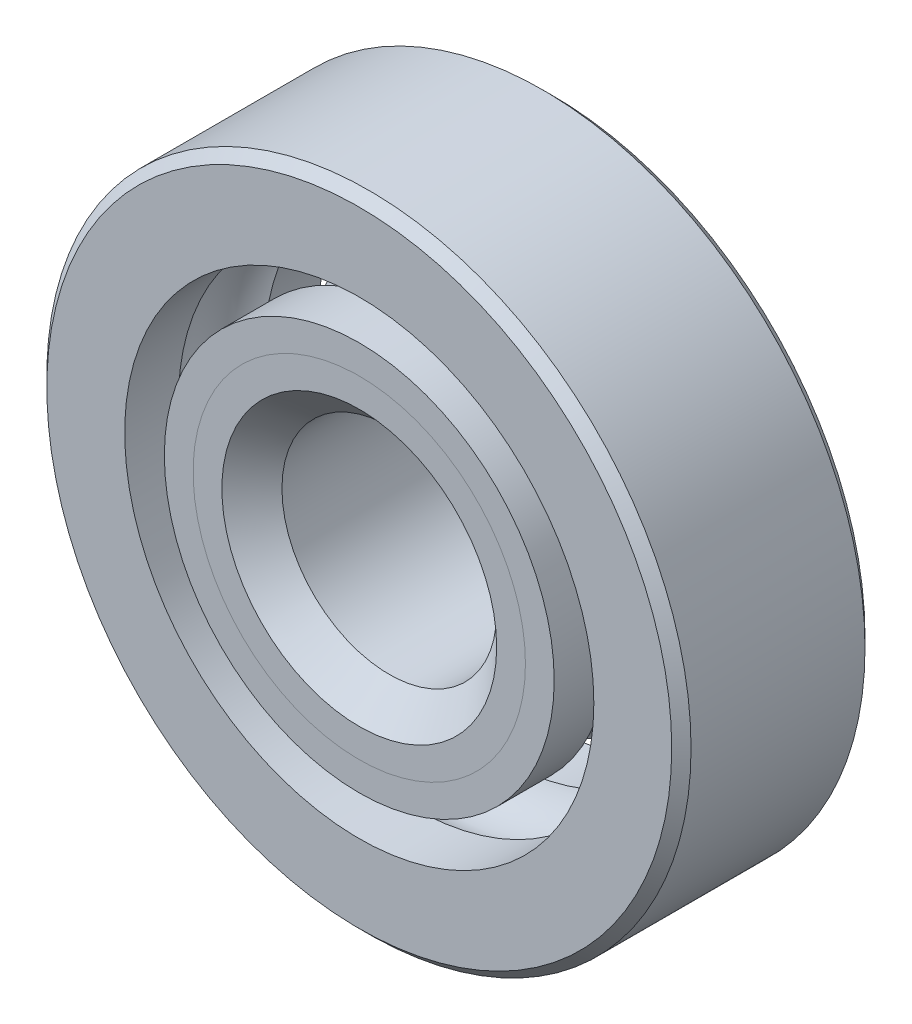
from build123d import *


with BuildPart() as part:
    # Sketch1 → Revolve1 (revolve)
    with BuildSketch(Plane(origin=(0, 0, 0), x_dir=(0, 0, -1), z_dir=(1, 0, 0))):
        with BuildLine():
            Line((4.05, 15), (-4.05, 15))
            Line((-4.05, 15), (-4.5, 14.55))
            Line((-4.5, 14.55), (-4.5, 10.923076923))
            Line((-4.5, 10.923076923), (-2, 10.923076923))
            ThreePointArc((-2, 10.923076923), (0, 12.202741702), (2, 10.923076923))
            Line((2, 10.923076923), (4.5, 10.923076923))
            Line((4.5, 10.923076923), (4.5, 14.55))
            Line((4.5, 14.55), (4.05, 15))
        make_face()
    revolve(axis=Axis((0, 0, 4.5), (0, 0, -1)))


with BuildPart() as body_2:
    # Sketch2 → Revolve2 (revolve)
    with BuildSketch(Plane(origin=(0, 0, 0), x_dir=(0, 0, -1), z_dir=(1, 0, 0))):
        with BuildLine():
            Line((-4.5, 9.076923077), (-2, 9.076923077))
            ThreePointArc((-2, 9.076923077), (-1.187175424, 8.144552475), (0, 7.797258298))
            Line((0, 7.797258298), (0, 6.398629149))
            Line((0, 6.398629149), (-3.160853036, 6.398629149))
            Line((-3.160853036, 6.398629149), (-4.5, 7.737776113))
            Line((-4.5, 7.737776113), (-4.5, 9.076923077))
        make_face()
    revolve(axis=Axis((0, 0, 4.5), (0, 0, -1)))


with BuildPart() as body_3:
    # Sketch3 → Revolve3 (revolve)
    with BuildSketch(Plane(origin=(0, 0, 0), x_dir=(0, 0, -1), z_dir=(1, 0, 0))):
        with BuildLine():
            Line((-4.5, 7.737776113), (-3.160853036, 6.398629149))
            Line((-3.160853036, 6.398629149), (0, 6.398629149))
            Line((0, 6.398629149), (0, 7.797258298))
            ThreePointArc((0, 7.797258298), (1.187175424, 8.144552475), (2, 9.076923077))
            Line((2, 9.076923077), (4.5, 9.076923077))
            Line((4.5, 9.076923077), (4.5, 5.45))
            Line((4.5, 5.45), (4.05, 5))
            Line((4.05, 5), (-3.101370851, 5))
            Line((-3.101370851, 5), (-4.5, 6.398629149))
            Line((-4.5, 6.398629149), (-4.5, 7.737776113))
        make_face()
    revolve(axis=Axis((0, 0, 4.5), (0, 0, -1)))


with BuildPart() as body_4:
    # Sketch4 → Revolve4 (revolve)
    with BuildSketch(Plane(origin=(0, 0, 0), x_dir=(0, 0, -1), z_dir=(1, 0, 0))):
        with BuildLine():
            Line((-2.202741702, 10), (2.202741702, 10))
            ThreePointArc((2.202741702, 10), (0, 12.202741702), (-2.202741702, 10))
        make_face()
    revolve(axis=Axis((0, 10, 2.202741702), (0, 0, -1)))


solid = Compound([part.part, body_2.part, body_3.part, body_4.part])
